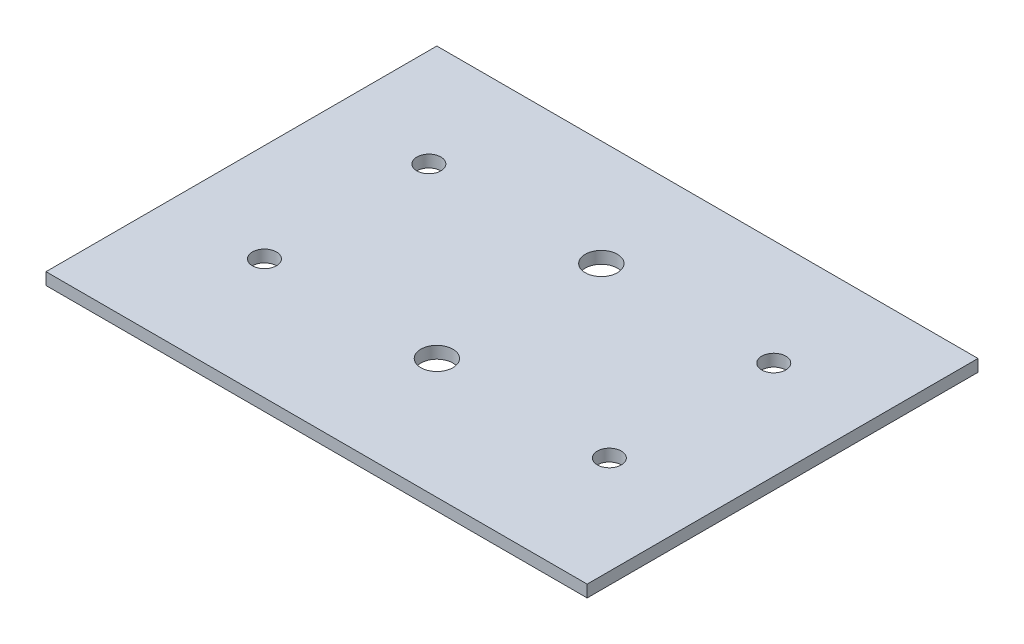
from build123d import *

# Parameters (mm, degrees)
SKETCH1_W           = 3373.54758581
SKETCH1_H           = 2436.451034196
SKETCH1_R           = 75
SKETCH1_R_2         = 100
BOSS_EXTRUDE1_DEPTH = 75


with BuildPart() as part:
    # Sketch1 → Boss-Extrude1 (new body)
    with BuildSketch(Plane(origin=(0, 0, 0), x_dir=(1, 0, 0), z_dir=(0, 1, 0))):
        Rectangle(SKETCH1_W, SKETCH1_H)
        with Locations(Location((1075, -468.225517098, 0), (0, 0, 270))):
            Circle(SKETCH1_R, mode=Mode.SUBTRACT)
        with Locations(Location((1075, 556.774482902, 0), (0, 0, 270))):
            Circle(SKETCH1_R, mode=Mode.SUBTRACT)
        with Locations(Location((-1075, -468.225517098, 0), (0, 0, 90))):
            Circle(SKETCH1_R, mode=Mode.SUBTRACT)
        with Locations(Location((-1075, 556.774482902, 0), (0, 0, 90))):
            Circle(SKETCH1_R, mode=Mode.SUBTRACT)
        with Locations(Location((0, -468.225517098, 0), (0, 0, 270))):
            Circle(SKETCH1_R_2, mode=Mode.SUBTRACT)
        with Locations(Location((0, 556.774482902, 0), (0, 0, 270))):
            Circle(SKETCH1_R_2, mode=Mode.SUBTRACT)
    extrude(amount=BOSS_EXTRUDE1_DEPTH)


solid = part.part
